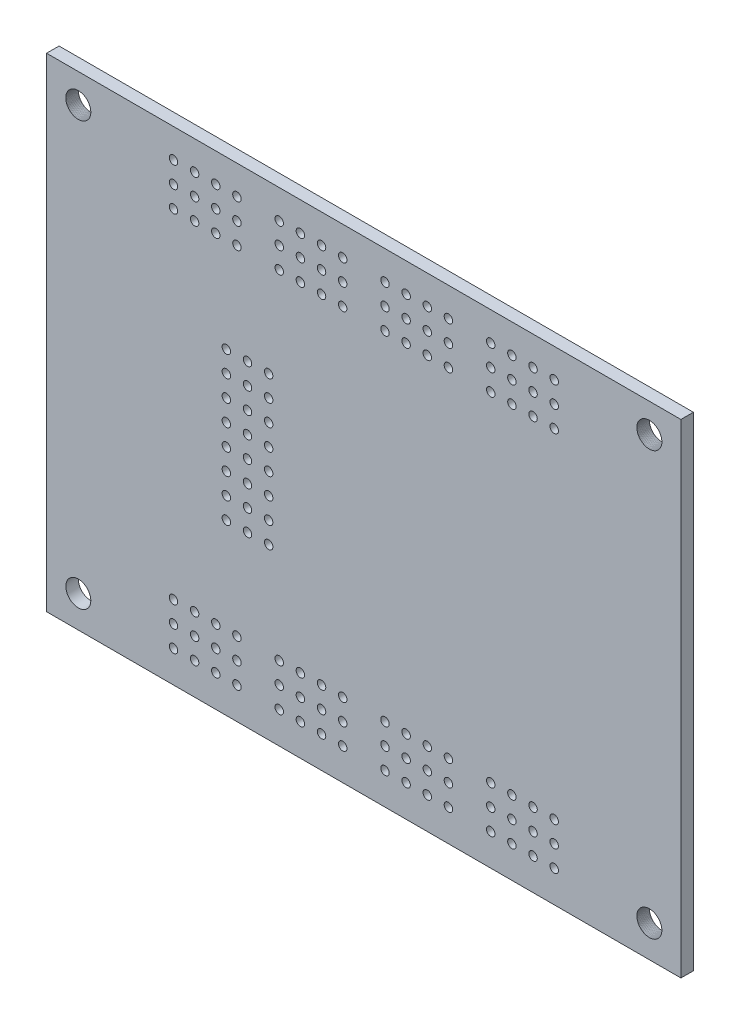
from build123d import *

# Parameters (mm, degrees)
SKETCH1_W           = 76.18
SKETCH1_H           = 58.09
SKETCH1_R           = 0.508
SKETCH1_R_2         = 1.5
BOSS_EXTRUDE1_DEPTH = 1.5


with BuildPart() as part:
    # Sketch1 → Boss-Extrude1 (new body)
    with BuildSketch(Plane.XY.offset(1.5)):
        with Locations((38.09, 29.045)):
            Rectangle(SKETCH1_W, SKETCH1_H)
        with Locations(Location((24.13, 20.32, 0), (0, 0, 180))):
            Circle(SKETCH1_R, mode=Mode.SUBTRACT)
        with Locations(Location((26.67, 22.86, 0), (0, 0, 180))):
            Circle(SKETCH1_R, mode=Mode.SUBTRACT)
        with Locations(Location((21.59, 22.86, 0), (0, 0, 180))):
            Circle(SKETCH1_R, mode=Mode.SUBTRACT)
        with Locations(Location((24.13, 25.4, 0), (0, 0, 180))):
            Circle(SKETCH1_R, mode=Mode.SUBTRACT)
        with Locations(Location((26.67, 27.94, 0), (0, 0, 180))):
            Circle(SKETCH1_R, mode=Mode.SUBTRACT)
        with Locations(Location((21.59, 27.94, 0), (0, 0, 180))):
            Circle(SKETCH1_R, mode=Mode.SUBTRACT)
        with Locations(Location((24.13, 30.48, 0), (0, 0, 180))):
            Circle(SKETCH1_R, mode=Mode.SUBTRACT)
        with Locations(Location((26.67, 33.02, 0), (0, 0, 180))):
            Circle(SKETCH1_R, mode=Mode.SUBTRACT)
        with Locations(Location((21.59, 33.02, 0), (0, 0, 180))):
            Circle(SKETCH1_R, mode=Mode.SUBTRACT)
        with Locations(Location((24.13, 35.56, 0), (0, 0, 180))):
            Circle(SKETCH1_R, mode=Mode.SUBTRACT)
        with Locations(Location((26.67, 38.1, 0), (0, 0, 180))):
            Circle(SKETCH1_R, mode=Mode.SUBTRACT)
        with Locations(Location((21.59, 38.1, 0), (0, 0, 180))):
            Circle(SKETCH1_R, mode=Mode.SUBTRACT)
        with Locations(Location((40.64, 6.35, 0), (0, 0, 180))):
            Circle(SKETCH1_R, mode=Mode.SUBTRACT)
        with Locations(Location((35.56, 8.89, 0), (0, 0, 180))):
            Circle(SKETCH1_R, mode=Mode.SUBTRACT)
        with Locations(Location((35.56, 3.81, 0), (0, 0, 180))):
            Circle(SKETCH1_R, mode=Mode.SUBTRACT)
        with Locations(Location((33.02, 6.35, 0), (0, 0, 180))):
            Circle(SKETCH1_R, mode=Mode.SUBTRACT)
        with Locations(Location((30.48, 8.89, 0), (0, 0, 180))):
            Circle(SKETCH1_R, mode=Mode.SUBTRACT)
        with Locations(Location((30.48, 3.81, 0), (0, 0, 180))):
            Circle(SKETCH1_R, mode=Mode.SUBTRACT)
        with Locations(Location((27.94, 6.35, 0), (0, 0, 180))):
            Circle(SKETCH1_R, mode=Mode.SUBTRACT)
        with Locations(Location((22.86, 8.89, 0), (0, 0, 180))):
            Circle(SKETCH1_R, mode=Mode.SUBTRACT)
        with Locations(Location((22.86, 3.81, 0), (0, 0, 180))):
            Circle(SKETCH1_R, mode=Mode.SUBTRACT)
        with Locations(Location((60.96, 52.07, 0), (0, 0, 180))):
            Circle(SKETCH1_R, mode=Mode.SUBTRACT)
        with Locations(Location((58.42, 54.61, 0), (0, 0, 180))):
            Circle(SKETCH1_R, mode=Mode.SUBTRACT)
        with Locations(Location((58.42, 49.53, 0), (0, 0, 180))):
            Circle(SKETCH1_R, mode=Mode.SUBTRACT)
        with Locations(Location((55.88, 52.07, 0), (0, 0, 180))):
            Circle(SKETCH1_R, mode=Mode.SUBTRACT)
        with Locations(Location((20.32, 8.89, 0), (0, 0, 180))):
            Circle(SKETCH1_R, mode=Mode.SUBTRACT)
        with Locations(Location((20.32, 3.81, 0), (0, 0, 180))):
            Circle(SKETCH1_R, mode=Mode.SUBTRACT)
        with Locations(Location((53.34, 52.07, 0), (0, 0, 180))):
            Circle(SKETCH1_R, mode=Mode.SUBTRACT)
        with Locations(Location((48.26, 54.61, 0), (0, 0, 180))):
            Circle(SKETCH1_R, mode=Mode.SUBTRACT)
        with Locations(Location((48.26, 49.53, 0), (0, 0, 180))):
            Circle(SKETCH1_R, mode=Mode.SUBTRACT)
        with Locations(Location((45.72, 52.07, 0), (0, 0, 180))):
            Circle(SKETCH1_R, mode=Mode.SUBTRACT)
        with Locations(Location((43.18, 54.61, 0), (0, 0, 180))):
            Circle(SKETCH1_R, mode=Mode.SUBTRACT)
        with Locations(Location((43.18, 49.53, 0), (0, 0, 180))):
            Circle(SKETCH1_R, mode=Mode.SUBTRACT)
        with Locations(Location((40.64, 52.07, 0), (0, 0, 180))):
            Circle(SKETCH1_R, mode=Mode.SUBTRACT)
        with Locations(Location((35.56, 54.61, 0), (0, 0, 180))):
            Circle(SKETCH1_R, mode=Mode.SUBTRACT)
        with Locations(Location((35.56, 49.53, 0), (0, 0, 180))):
            Circle(SKETCH1_R, mode=Mode.SUBTRACT)
        with Locations(Location((33.02, 52.07, 0), (0, 0, 180))):
            Circle(SKETCH1_R, mode=Mode.SUBTRACT)
        with Locations(Location((30.48, 54.61, 0), (0, 0, 180))):
            Circle(SKETCH1_R, mode=Mode.SUBTRACT)
        with Locations(Location((30.48, 49.53, 0), (0, 0, 180))):
            Circle(SKETCH1_R, mode=Mode.SUBTRACT)
        with Locations(Location((27.94, 52.07, 0), (0, 0, 180))):
            Circle(SKETCH1_R, mode=Mode.SUBTRACT)
        with Locations(Location((22.86, 54.61, 0), (0, 0, 180))):
            Circle(SKETCH1_R, mode=Mode.SUBTRACT)
        with Locations(Location((22.86, 49.53, 0), (0, 0, 180))):
            Circle(SKETCH1_R, mode=Mode.SUBTRACT)
        with Locations(Location((17.78, 6.35, 0), (0, 0, 180))):
            Circle(SKETCH1_R, mode=Mode.SUBTRACT)
        with Locations(Location((20.32, 54.61, 0), (0, 0, 180))):
            Circle(SKETCH1_R, mode=Mode.SUBTRACT)
        with Locations(Location((20.32, 49.53, 0), (0, 0, 180))):
            Circle(SKETCH1_R, mode=Mode.SUBTRACT)
        with Locations(Location((17.78, 52.07, 0), (0, 0, 180))):
            Circle(SKETCH1_R, mode=Mode.SUBTRACT)
        with Locations(Location((15.24, 54.61, 0), (0, 0, 180))):
            Circle(SKETCH1_R, mode=Mode.SUBTRACT)
        with Locations(Location((15.24, 49.53, 0), (0, 0, 180))):
            Circle(SKETCH1_R, mode=Mode.SUBTRACT)
        with Locations(Location((60.96, 6.35, 0), (0, 0, 180))):
            Circle(SKETCH1_R, mode=Mode.SUBTRACT)
        with Locations(Location((58.42, 8.89, 0), (0, 0, 180))):
            Circle(SKETCH1_R, mode=Mode.SUBTRACT)
        with Locations(Location((58.42, 3.81, 0), (0, 0, 180))):
            Circle(SKETCH1_R, mode=Mode.SUBTRACT)
        with Locations(Location((55.88, 6.35, 0), (0, 0, 180))):
            Circle(SKETCH1_R, mode=Mode.SUBTRACT)
        with Locations(Location((53.34, 8.89, 0), (0, 0, 180))):
            Circle(SKETCH1_R, mode=Mode.SUBTRACT)
        with Locations(Location((53.34, 3.81, 0), (0, 0, 180))):
            Circle(SKETCH1_R, mode=Mode.SUBTRACT)
        with Locations(Location((48.26, 6.35, 0), (0, 0, 180))):
            Circle(SKETCH1_R, mode=Mode.SUBTRACT)
        with Locations(Location((45.72, 8.89, 0), (0, 0, 180))):
            Circle(SKETCH1_R, mode=Mode.SUBTRACT)
        with Locations(Location((45.72, 3.81, 0), (0, 0, 180))):
            Circle(SKETCH1_R, mode=Mode.SUBTRACT)
        with Locations(Location((43.18, 6.35, 0), (0, 0, 180))):
            Circle(SKETCH1_R, mode=Mode.SUBTRACT)
        with Locations(Location((15.24, 8.89, 0), (0, 0, 180))):
            Circle(SKETCH1_R, mode=Mode.SUBTRACT)
        with Locations(Location((15.24, 3.81, 0), (0, 0, 180))):
            Circle(SKETCH1_R, mode=Mode.SUBTRACT)
        with Locations(Location((15.24, 6.35, 0), (0, 0, 180))):
            Circle(SKETCH1_R, mode=Mode.SUBTRACT)
        with Locations(Location((43.18, 3.81, 0), (0, 0, 180))):
            Circle(SKETCH1_R, mode=Mode.SUBTRACT)
        with Locations(Location((43.18, 8.89, 0), (0, 0, 180))):
            Circle(SKETCH1_R, mode=Mode.SUBTRACT)
        with Locations(Location((45.72, 6.35, 0), (0, 0, 180))):
            Circle(SKETCH1_R, mode=Mode.SUBTRACT)
        with Locations(Location((48.26, 3.81, 0), (0, 0, 180))):
            Circle(SKETCH1_R, mode=Mode.SUBTRACT)
        with Locations(Location((48.26, 8.89, 0), (0, 0, 180))):
            Circle(SKETCH1_R, mode=Mode.SUBTRACT)
        with Locations(Location((53.34, 6.35, 0), (0, 0, 180))):
            Circle(SKETCH1_R, mode=Mode.SUBTRACT)
        with Locations(Location((55.88, 3.81, 0), (0, 0, 180))):
            Circle(SKETCH1_R, mode=Mode.SUBTRACT)
        with Locations(Location((55.88, 8.89, 0), (0, 0, 180))):
            Circle(SKETCH1_R, mode=Mode.SUBTRACT)
        with Locations(Location((58.42, 6.35, 0), (0, 0, 180))):
            Circle(SKETCH1_R, mode=Mode.SUBTRACT)
        with Locations(Location((60.96, 3.81, 0), (0, 0, 180))):
            Circle(SKETCH1_R, mode=Mode.SUBTRACT)
        with Locations(Location((60.96, 8.89, 0), (0, 0, 180))):
            Circle(SKETCH1_R, mode=Mode.SUBTRACT)
        with Locations(Location((15.24, 52.07, 0), (0, 0, 180))):
            Circle(SKETCH1_R, mode=Mode.SUBTRACT)
        with Locations(Location((17.78, 49.53, 0), (0, 0, 180))):
            Circle(SKETCH1_R, mode=Mode.SUBTRACT)
        with Locations(Location((17.78, 54.61, 0), (0, 0, 180))):
            Circle(SKETCH1_R, mode=Mode.SUBTRACT)
        with Locations(Location((20.32, 52.07, 0), (0, 0, 180))):
            Circle(SKETCH1_R, mode=Mode.SUBTRACT)
        with Locations(Location((17.78, 3.81, 0), (0, 0, 180))):
            Circle(SKETCH1_R, mode=Mode.SUBTRACT)
        with Locations(Location((17.78, 8.89, 0), (0, 0, 180))):
            Circle(SKETCH1_R, mode=Mode.SUBTRACT)
        with Locations(Location((22.86, 52.07, 0), (0, 0, 180))):
            Circle(SKETCH1_R, mode=Mode.SUBTRACT)
        with Locations(Location((27.94, 49.53, 0), (0, 0, 180))):
            Circle(SKETCH1_R, mode=Mode.SUBTRACT)
        with Locations(Location((27.94, 54.61, 0), (0, 0, 180))):
            Circle(SKETCH1_R, mode=Mode.SUBTRACT)
        with Locations(Location((30.48, 52.07, 0), (0, 0, 180))):
            Circle(SKETCH1_R, mode=Mode.SUBTRACT)
        with Locations(Location((33.02, 49.53, 0), (0, 0, 180))):
            Circle(SKETCH1_R, mode=Mode.SUBTRACT)
        with Locations(Location((33.02, 54.61, 0), (0, 0, 180))):
            Circle(SKETCH1_R, mode=Mode.SUBTRACT)
        with Locations(Location((35.56, 52.07, 0), (0, 0, 180))):
            Circle(SKETCH1_R, mode=Mode.SUBTRACT)
        with Locations(Location((40.64, 49.53, 0), (0, 0, 180))):
            Circle(SKETCH1_R, mode=Mode.SUBTRACT)
        with Locations(Location((40.64, 54.61, 0), (0, 0, 180))):
            Circle(SKETCH1_R, mode=Mode.SUBTRACT)
        with Locations(Location((43.18, 52.07, 0), (0, 0, 180))):
            Circle(SKETCH1_R, mode=Mode.SUBTRACT)
        with Locations(Location((45.72, 49.53, 0), (0, 0, 180))):
            Circle(SKETCH1_R, mode=Mode.SUBTRACT)
        with Locations(Location((45.72, 54.61, 0), (0, 0, 180))):
            Circle(SKETCH1_R, mode=Mode.SUBTRACT)
        with Locations(Location((48.26, 52.07, 0), (0, 0, 180))):
            Circle(SKETCH1_R, mode=Mode.SUBTRACT)
        with Locations(Location((53.34, 49.53, 0), (0, 0, 180))):
            Circle(SKETCH1_R, mode=Mode.SUBTRACT)
        with Locations(Location((53.34, 54.61, 0), (0, 0, 180))):
            Circle(SKETCH1_R, mode=Mode.SUBTRACT)
        with Locations(Location((20.32, 6.35, 0), (0, 0, 180))):
            Circle(SKETCH1_R, mode=Mode.SUBTRACT)
        with Locations(Location((55.88, 49.53, 0), (0, 0, 180))):
            Circle(SKETCH1_R, mode=Mode.SUBTRACT)
        with Locations(Location((55.88, 54.61, 0), (0, 0, 180))):
            Circle(SKETCH1_R, mode=Mode.SUBTRACT)
        with Locations(Location((58.42, 52.07, 0), (0, 0, 180))):
            Circle(SKETCH1_R, mode=Mode.SUBTRACT)
        with Locations(Location((60.96, 49.53, 0), (0, 0, 180))):
            Circle(SKETCH1_R, mode=Mode.SUBTRACT)
        with Locations(Location((60.96, 54.61, 0), (0, 0, 180))):
            Circle(SKETCH1_R, mode=Mode.SUBTRACT)
        with Locations(Location((22.86, 6.35, 0), (0, 0, 180))):
            Circle(SKETCH1_R, mode=Mode.SUBTRACT)
        with Locations(Location((27.94, 3.81, 0), (0, 0, 180))):
            Circle(SKETCH1_R, mode=Mode.SUBTRACT)
        with Locations(Location((27.94, 8.89, 0), (0, 0, 180))):
            Circle(SKETCH1_R, mode=Mode.SUBTRACT)
        with Locations(Location((30.48, 6.35, 0), (0, 0, 180))):
            Circle(SKETCH1_R, mode=Mode.SUBTRACT)
        with Locations(Location((33.02, 3.81, 0), (0, 0, 180))):
            Circle(SKETCH1_R, mode=Mode.SUBTRACT)
        with Locations(Location((33.02, 8.89, 0), (0, 0, 180))):
            Circle(SKETCH1_R, mode=Mode.SUBTRACT)
        with Locations(Location((35.56, 6.35, 0), (0, 0, 180))):
            Circle(SKETCH1_R, mode=Mode.SUBTRACT)
        with Locations(Location((40.64, 3.81, 0), (0, 0, 180))):
            Circle(SKETCH1_R, mode=Mode.SUBTRACT)
        with Locations(Location((40.64, 8.89, 0), (0, 0, 180))):
            Circle(SKETCH1_R, mode=Mode.SUBTRACT)
        with Locations(Location((24.13, 38.1, 0), (0, 0, 180))):
            Circle(SKETCH1_R, mode=Mode.SUBTRACT)
        with Locations(Location((21.59, 35.56, 0), (0, 0, 180))):
            Circle(SKETCH1_R, mode=Mode.SUBTRACT)
        with Locations(Location((26.67, 35.56, 0), (0, 0, 180))):
            Circle(SKETCH1_R, mode=Mode.SUBTRACT)
        with Locations(Location((24.13, 33.02, 0), (0, 0, 180))):
            Circle(SKETCH1_R, mode=Mode.SUBTRACT)
        with Locations(Location((21.59, 30.48, 0), (0, 0, 180))):
            Circle(SKETCH1_R, mode=Mode.SUBTRACT)
        with Locations(Location((26.67, 30.48, 0), (0, 0, 180))):
            Circle(SKETCH1_R, mode=Mode.SUBTRACT)
        with Locations(Location((24.13, 27.94, 0), (0, 0, 180))):
            Circle(SKETCH1_R, mode=Mode.SUBTRACT)
        with Locations(Location((21.59, 25.4, 0), (0, 0, 180))):
            Circle(SKETCH1_R, mode=Mode.SUBTRACT)
        with Locations(Location((26.67, 25.4, 0), (0, 0, 180))):
            Circle(SKETCH1_R, mode=Mode.SUBTRACT)
        with Locations(Location((24.13, 22.86, 0), (0, 0, 180))):
            Circle(SKETCH1_R, mode=Mode.SUBTRACT)
        with Locations(Location((21.59, 20.32, 0), (0, 0, 180))):
            Circle(SKETCH1_R, mode=Mode.SUBTRACT)
        with Locations(Location((26.67, 20.32, 0), (0, 0, 180))):
            Circle(SKETCH1_R, mode=Mode.SUBTRACT)
        with Locations(Location((3.81, 3.81, 0), (0, 0, 180))):
            Circle(SKETCH1_R_2, mode=Mode.SUBTRACT)
        Polygon((5.30236, 54.7704), (5.31, 54.6636), (5.31, 54.5564), (5.30236, 54.4496), (5.28711, 54.3435), (5.26433, 54.2388), (5.23415, 54.136), (5.1967, 54.0356), (5.15219, 53.9381), (5.10084, 53.8441), (5.04292, 53.754), (4.97871, 53.6682), (4.90854, 53.5872), (4.83278, 53.5115), (4.7518, 53.4413), (4.66603, 53.3771), (4.57589, 53.3192), (4.48185, 53.2678), (4.38439, 53.2233), (4.284, 53.1859), (4.1812, 53.1557), (4.0765, 53.1329), (3.97044, 53.1176), (3.86357, 53.11), (3.75643, 53.11), (3.64956, 53.1176), (3.5435, 53.1329), (3.4388, 53.1557), (3.336, 53.1859), (3.23561, 53.2233), (3.13815, 53.2678), (3.04411, 53.3192), (2.95397, 53.3771), (2.8682, 53.4413), (2.78722, 53.5115), (2.71146, 53.5872), (2.64129, 53.6682), (2.57708, 53.754), (2.51916, 53.8441), (2.46781, 53.9381), (2.4233, 54.0356), (2.38585, 54.136), (2.35567, 54.2388), (2.33289, 54.3435), (2.31764, 54.4496), (2.31, 54.5564), (2.31, 54.6636), (2.31764, 54.7704), (2.33289, 54.8765), (2.35567, 54.9812), (2.38585, 55.084), (2.4233, 55.1844), (2.46781, 55.2819), (2.51916, 55.3759), (2.57708, 55.466), (2.64129, 55.5518), (2.71146, 55.6328), (2.78722, 55.7085), (2.8682, 55.7787), (2.95397, 55.8429), (3.04411, 55.9008), (3.13815, 55.9522), (3.23561, 55.9967), (3.336, 56.0341), (3.4388, 56.0643), (3.5435, 56.0871), (3.64956, 56.1024), (3.75643, 56.11), (3.86357, 56.11), (3.97044, 56.1024), (4.0765, 56.0871), (4.1812, 56.0643), (4.284, 56.0341), (4.38439, 55.9967), (4.48185, 55.9522), (4.57589, 55.9008), (4.66603, 55.8429), (4.7518, 55.7787), (4.83278, 55.7085), (4.90854, 55.6328), (4.97871, 55.5518), (5.04292, 55.466), (5.10084, 55.3759), (5.15219, 55.2819), (5.1967, 55.1844), (5.23415, 55.084), (5.26433, 54.9812), (5.28711, 54.8765), align=None, mode=Mode.SUBTRACT)
        Polygon((73.8824, 54.7704), (73.89, 54.6636), (73.89, 54.5564), (73.8824, 54.4496), (73.8671, 54.3435), (73.8443, 54.2388), (73.8141, 54.136), (73.7767, 54.0356), (73.7322, 53.9381), (73.6808, 53.8441), (73.6229, 53.754), (73.5587, 53.6682), (73.4885, 53.5872), (73.4128, 53.5115), (73.3318, 53.4413), (73.246, 53.3771), (73.1559, 53.3192), (73.0619, 53.2678), (72.9644, 53.2233), (72.864, 53.1859), (72.7612, 53.1557), (72.6565, 53.1329), (72.5504, 53.1176), (72.4436, 53.11), (72.3364, 53.11), (72.2296, 53.1176), (72.1235, 53.1329), (72.0188, 53.1557), (71.916, 53.1859), (71.8156, 53.2233), (71.7181, 53.2678), (71.6241, 53.3192), (71.534, 53.3771), (71.4482, 53.4413), (71.3672, 53.5115), (71.2915, 53.5872), (71.2213, 53.6682), (71.1571, 53.754), (71.0992, 53.8441), (71.0478, 53.9381), (71.0033, 54.0356), (70.9659, 54.136), (70.9357, 54.2388), (70.9129, 54.3435), (70.8976, 54.4496), (70.89, 54.5564), (70.89, 54.6636), (70.8976, 54.7704), (70.9129, 54.8765), (70.9357, 54.9812), (70.9659, 55.084), (71.0033, 55.1844), (71.0478, 55.2819), (71.0992, 55.3759), (71.1571, 55.466), (71.2213, 55.5518), (71.2915, 55.6328), (71.3672, 55.7085), (71.4482, 55.7787), (71.534, 55.8429), (71.6241, 55.9008), (71.7181, 55.9522), (71.8156, 55.9967), (71.916, 56.0341), (72.0188, 56.0643), (72.1235, 56.0871), (72.2296, 56.1024), (72.3364, 56.11), (72.4436, 56.11), (72.5504, 56.1024), (72.6565, 56.0871), (72.7612, 56.0643), (72.864, 56.0341), (72.9644, 55.9967), (73.0619, 55.9522), (73.1559, 55.9008), (73.246, 55.8429), (73.3318, 55.7787), (73.4128, 55.7085), (73.4885, 55.6328), (73.5587, 55.5518), (73.6229, 55.466), (73.6808, 55.3759), (73.7322, 55.2819), (73.7767, 55.1844), (73.8141, 55.084), (73.8443, 54.9812), (73.8671, 54.8765), align=None, mode=Mode.SUBTRACT)
        Polygon((73.8824, 3.97044), (73.89, 3.86357), (73.89, 3.75643), (73.8824, 3.64956), (73.8671, 3.5435), (73.8443, 3.4388), (73.8141, 3.336), (73.7767, 3.23561), (73.7322, 3.13815), (73.6808, 3.04411), (73.6229, 2.95397), (73.5587, 2.8682), (73.4885, 2.78722), (73.4128, 2.71146), (73.3318, 2.64129), (73.246, 2.57708), (73.1559, 2.51916), (73.0619, 2.46781), (72.9644, 2.4233), (72.864, 2.38585), (72.7612, 2.35567), (72.6565, 2.33289), (72.5504, 2.31764), (72.4436, 2.31), (72.3364, 2.31), (72.2296, 2.31764), (72.1235, 2.33289), (72.0188, 2.35567), (71.916, 2.38585), (71.8156, 2.4233), (71.7181, 2.46781), (71.6241, 2.51916), (71.534, 2.57708), (71.4482, 2.64129), (71.3672, 2.71146), (71.2915, 2.78722), (71.2213, 2.8682), (71.1571, 2.95397), (71.0992, 3.04411), (71.0478, 3.13815), (71.0033, 3.23561), (70.9659, 3.336), (70.9357, 3.4388), (70.9129, 3.5435), (70.8976, 3.64956), (70.89, 3.75643), (70.89, 3.86357), (70.8976, 3.97044), (70.9129, 4.0765), (70.9357, 4.1812), (70.9659, 4.284), (71.0033, 4.38439), (71.0478, 4.48185), (71.0992, 4.57589), (71.1571, 4.66603), (71.2213, 4.7518), (71.2915, 4.83278), (71.3672, 4.90854), (71.4482, 4.97871), (71.534, 5.04292), (71.6241, 5.10084), (71.7181, 5.15219), (71.8156, 5.1967), (71.916, 5.23415), (72.0188, 5.26433), (72.1235, 5.28711), (72.2296, 5.30236), (72.3364, 5.31), (72.4436, 5.31), (72.5504, 5.30236), (72.6565, 5.28711), (72.7612, 5.26433), (72.864, 5.23415), (72.9644, 5.1967), (73.0619, 5.15219), (73.1559, 5.10084), (73.246, 5.04292), (73.3318, 4.97871), (73.4128, 4.90854), (73.4885, 4.83278), (73.5587, 4.7518), (73.6229, 4.66603), (73.6808, 4.57589), (73.7322, 4.48185), (73.7767, 4.38439), (73.8141, 4.284), (73.8443, 4.1812), (73.8671, 4.0765), align=None, mode=Mode.SUBTRACT)
    extrude(amount=-BOSS_EXTRUDE1_DEPTH)


solid = part.part
